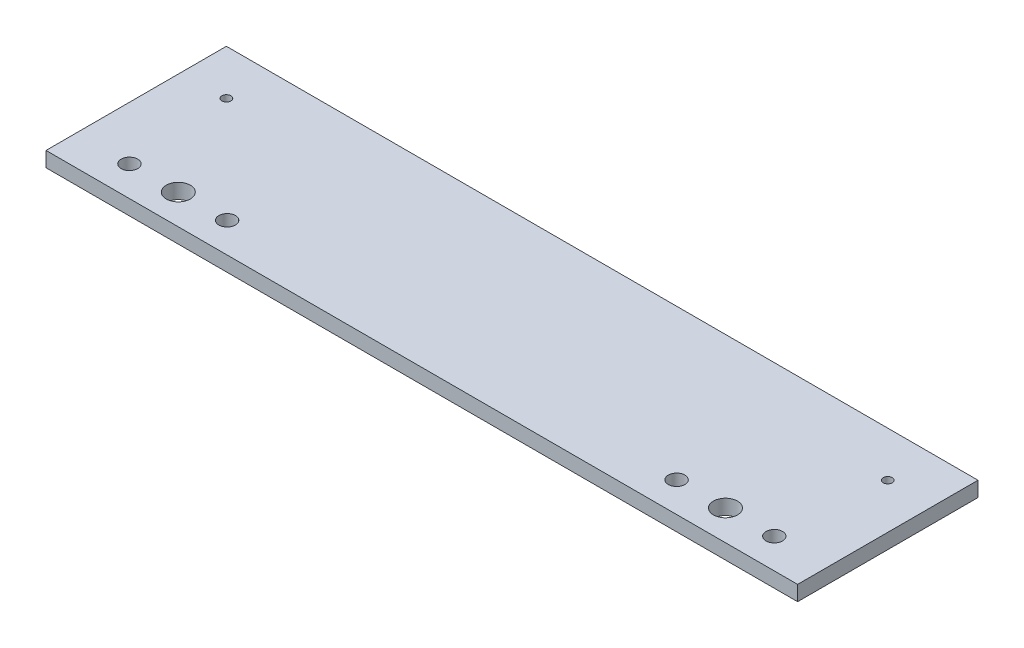
from build123d import *

# Parameters (mm, degrees)
SKETCH1_W           = 250
SKETCH1_H           = 60
SKETCH1_R           = 4
BOSS_EXTRUDE1_DEPTH = 5
SKETCH2_R           = 1.5
SKETCH2_R_2         = 2.75
CUT_EXTRUDE1_DEPTH  = 10


with BuildPart() as part:
    # Sketch1 → Boss-Extrude1 (new body)
    with BuildSketch(Plane(origin=(0, 0, 0), x_dir=(1, 0, 0), z_dir=(0, 1, 0))):
        with Locations((0, -15)):
            Rectangle(SKETCH1_W, SKETCH1_H)
        with Locations(Location((-91, -35, 0), (0, 0, 270))):
            Circle(SKETCH1_R, mode=Mode.SUBTRACT)
        with Locations(Location((91, -35, 0), (0, 0, 90))):
            Circle(SKETCH1_R, mode=Mode.SUBTRACT)
    extrude(amount=BOSS_EXTRUDE1_DEPTH)

    # Sketch2 → Cut-Extrude1 (cut)
    with BuildSketch(Plane.XZ):
        with Locations(Location((110, 0, 0), (0, 0, 270))):
            Circle(SKETCH2_R)
        with Locations(Location((74.75, 35, 0), (0, 0, 270))):
            Circle(SKETCH2_R_2)
        with Locations(Location((107.25, 35, 0), (0, 0, 270))):
            Circle(SKETCH2_R_2)
        with Locations(Location((-110, 0, 0), (0, 0, 270))):
            Circle(SKETCH2_R)
        with Locations(Location((-74.75, 35, 0), (0, 0, 270))):
            Circle(SKETCH2_R_2)
        with Locations(Location((-107.25, 35, 0), (0, 0, 270))):
            Circle(SKETCH2_R_2)
    extrude(amount=-CUT_EXTRUDE1_DEPTH, mode=Mode.SUBTRACT)


solid = part.part
